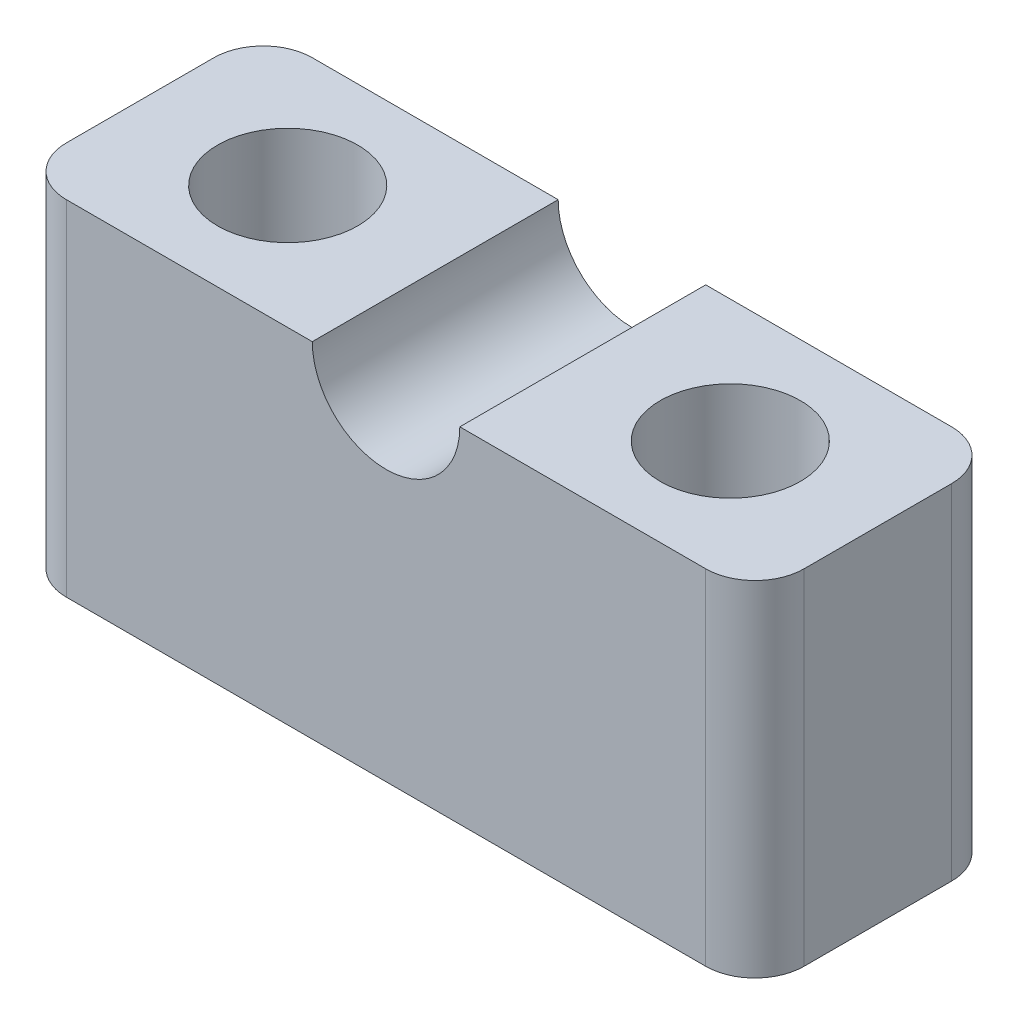
from build123d import *

# Parameters (mm, degrees)
SKETCH1_W           = 15
SKETCH1_H           = 5
BOSS_EXTRUDE1_DEPTH = 7
SKETCH2_R           = 1.5
CUT_EXTRUDE1_DEPTH  = 14.917492532
SKETCH3_R           = 1.425
CUT_EXTRUDE2_DEPTH  = 14.296591966
FILLET1_R           = 1


with BuildPart() as part:
    # Sketch1 → Boss-Extrude1 (new body)
    with BuildSketch(Plane(origin=(0, 0, 0), x_dir=(1, 0, 0), z_dir=(0, 1, 0))):
        with Locations((3.440594059, 0.346534653)):
            Rectangle(SKETCH1_W, SKETCH1_H)
    extrude(amount=BOSS_EXTRUDE1_DEPTH)

    # Sketch2 → Cut-Extrude1 (cut, through all)
    with BuildSketch(Plane(origin=(0, 0, -2.846534653), x_dir=(-1, 0, 0), z_dir=(0, 0, -1))):
        with Locations((-3.440594059, 7)):
            Circle(SKETCH2_R)
    extrude(amount=-CUT_EXTRUDE1_DEPTH, mode=Mode.SUBTRACT)

    # Sketch3 → Cut-Extrude2 (cut, through all)
    with BuildSketch(Plane(origin=(0, 7, 0), x_dir=(1, 0, 0), z_dir=(0, 1, 0))):
        with Locations(Location((7.940594059, 0.346534653, 0), (0, 0, 270))):
            Circle(SKETCH3_R)
        with Locations(Location((-1.059405941, 0.346534653, 0), (0, 0, 270))):
            Circle(SKETCH3_R)
    extrude(amount=-CUT_EXTRUDE2_DEPTH, mode=Mode.SUBTRACT)

    # Fillet1
    fillet1_edges = [part.edges().sort_by_distance(p)[0] for p in [
        (-4.059405941, 3.5, -2.846534653),
        (10.940594059, 3.5, -2.846534653),
        (10.940594059, 3.5, 2.153465347),
        (-4.059405941, 3.5, 2.153465347),
    ]]
    fillet(fillet1_edges, radius=FILLET1_R)


solid = part.part
